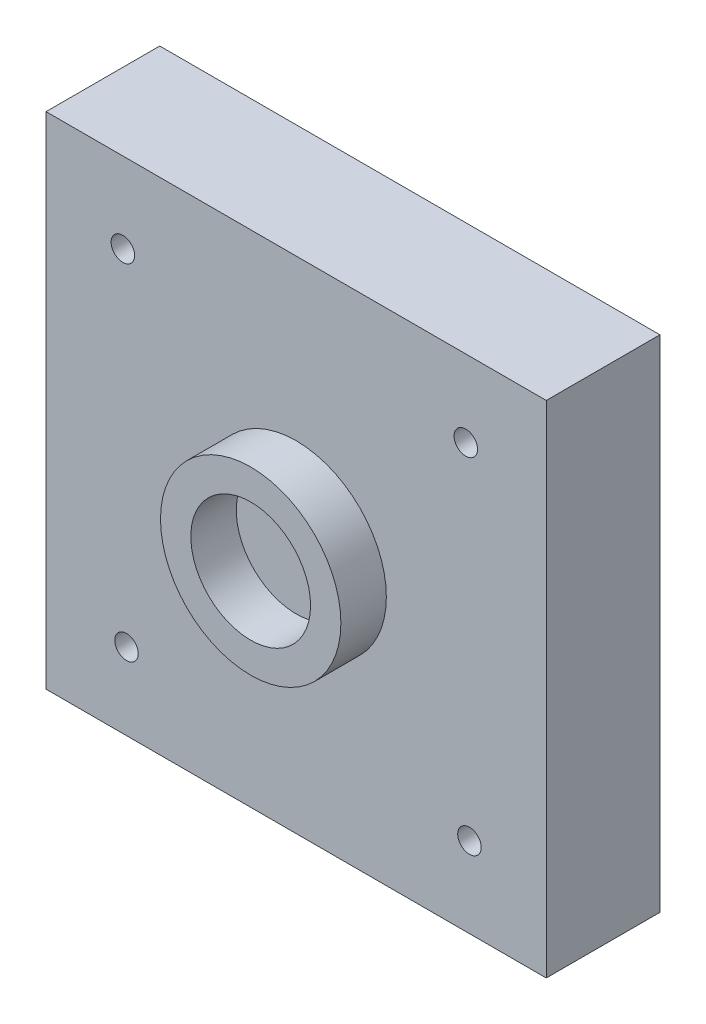
from build123d import *

# Parameters (mm, degrees)
SKETCH1_W           = 66
SKETCH1_H           = 66
SKETCH1_W_2         = 60
SKETCH1_H_2         = 60
EXTRUDE_THIN1_DEPTH = 15
BOSS_EXTRUDE1_START = 15
SKETCH1_2_W         = 60
SKETCH1_2_H         = 60
BOSS_EXTRUDE1_DEPTH = 5
SKETCH2_R           = 1.55
CUT_EXTRUDE1_DEPTH  = 50.020403915
SKETCH2_2_R         = 3.55
SKETCH2_2_R_2       = 1.55
EXTRUDE_THIN2_DEPTH = 15
SKETCH3_R           = 11.9
SKETCH3_R_2         = 7.9
BOSS_EXTRUDE2_DEPTH = 6


with BuildPart() as part:
    # Sketch1 → Extrude-Thin1 (new body)
    with BuildSketch(Plane.XY):
        Rectangle(SKETCH1_W, SKETCH1_H)
        Rectangle(SKETCH1_W_2, SKETCH1_H_2, mode=Mode.SUBTRACT)
    extrude(amount=EXTRUDE_THIN1_DEPTH)

    # Sketch1<2> → Boss-Extrude1 (add)
    with BuildSketch(Plane.XY.offset(BOSS_EXTRUDE1_START)):
        Rectangle(SKETCH1_2_W, SKETCH1_2_H)
    extrude(amount=-BOSS_EXTRUDE1_DEPTH)

    # Sketch2 → Cut-Extrude1 (cut, through all)
    with BuildSketch(Plane.XY.offset(15)):
        with Locations((22.384300197, 22.867949289)):
            Circle(SKETCH2_R)
        with Locations((22.867949289, -22.384300197)):
            Circle(SKETCH2_R)
        with Locations((-22.384300197, -22.867949289)):
            Circle(SKETCH2_R)
        with Locations((-22.867949289, 22.384300197)):
            Circle(SKETCH2_R)
    extrude(amount=-CUT_EXTRUDE1_DEPTH, mode=Mode.SUBTRACT)

    # Sketch2<2> → Extrude-Thin2 (add)
    # profile 1 of 4: a face of its own
    with BuildSketch(Plane.XY.offset(15)):
        with Locations((22.384300197, 22.867949289)):
            Circle(SKETCH2_2_R)
        with Locations((22.384300197, 22.867949289)):
            Circle(SKETCH2_2_R_2, mode=Mode.SUBTRACT)
    # profile 2 of 4: a face of its own
    with BuildSketch(Plane.XY.offset(15)):
        with Locations((22.867949289, -22.384300197)):
            Circle(SKETCH2_2_R)
        with Locations((22.867949289, -22.384300197)):
            Circle(SKETCH2_2_R_2, mode=Mode.SUBTRACT)
    # profile 3 of 4: a face of its own
    with BuildSketch(Plane.XY.offset(15)):
        with Locations((-22.384300197, -22.867949289)):
            Circle(SKETCH2_2_R)
        with Locations((-22.384300197, -22.867949289)):
            Circle(SKETCH2_2_R_2, mode=Mode.SUBTRACT)
    # profile 4 of 4: a face of its own
    with BuildSketch(Plane.XY.offset(15)):
        with Locations((-22.867949289, 22.384300197)):
            Circle(SKETCH2_2_R)
        with Locations((-22.867949289, 22.384300197)):
            Circle(SKETCH2_2_R_2, mode=Mode.SUBTRACT)
    extrude(amount=-EXTRUDE_THIN2_DEPTH)

    # Sketch3 → Boss-Extrude2 (add)
    with BuildSketch(Plane.XY.offset(15)):
        Circle(SKETCH3_R)
        Circle(SKETCH3_R_2, mode=Mode.SUBTRACT)
    extrude(amount=BOSS_EXTRUDE2_DEPTH)


solid = part.part
